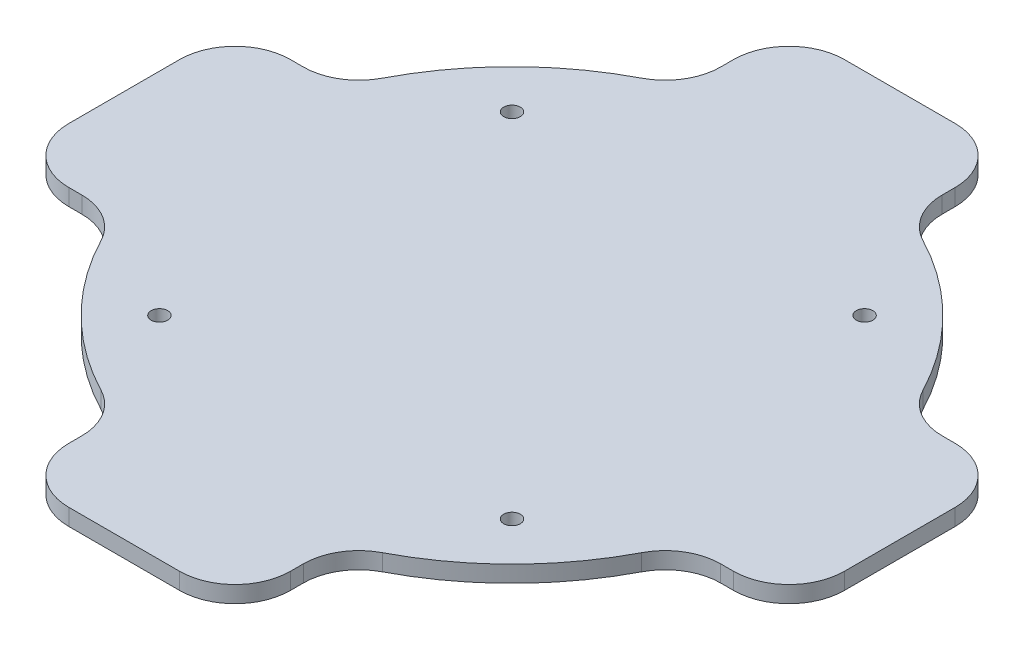
from build123d import *

# Parameters (mm, degrees)
SKETCH_1_R      = 0.75
EXTRUDE_2_DEPTH = 1.5


with BuildPart() as part:
    # 草图1 → 凸台-拉伸2 (new body)
    with BuildSketch(Plane(origin=(0, 0, 0), x_dir=(1, 0, 0), z_dir=(0, 1, 0))):
        with BuildLine():
            Line((28.831406487, -10), (30, -10))
            ThreePointArc((30, -10), (33.535533906, -8.535533906), (35, -5))
            Line((35, -5), (35, 0))
            Line((35, 0), (35, 5))
            ThreePointArc((35, 5), (33.535533906, 8.535533906), (30, 10))
            Line((30, 10), (28.831406487, 10))
            ThreePointArc((28.831406487, 10), (26.237033878, 10.725747929), (24.395805489, 12.692307692))
            ThreePointArc((24.395805489, 12.692307692), (19.445436483, 19.445436483), (12.692307692, 24.395805489))
            ThreePointArc((12.692307692, 24.395805489), (10.725747929, 26.237033878), (10, 28.831406487))
            Line((10, 28.831406487), (10, 30))
            ThreePointArc((10, 30), (8.535533906, 33.535533906), (5, 35))
            Line((5, 35), (0, 35))
            Line((0, 35), (-5, 35))
            ThreePointArc((-5, 35), (-8.535533906, 33.535533906), (-10, 30))
            Line((-10, 30), (-10, 28.831406487))
            ThreePointArc((-10, 28.831406487), (-10.725747929, 26.237033878), (-12.692307692, 24.395805489))
            ThreePointArc((-12.692307692, 24.395805489), (-19.445436483, 19.445436483), (-24.395805489, 12.692307692))
            ThreePointArc((-24.395805489, 12.692307692), (-26.237033878, 10.725747929), (-28.831406487, 10))
            Line((-28.831406487, 10), (-30, 10))
            ThreePointArc((-30, 10), (-33.535533906, 8.535533906), (-35, 5))
            Line((-35, 5), (-35, 0))
            Line((-35, 0), (-35, -5))
            ThreePointArc((-35, -5), (-33.535533906, -8.535533906), (-30, -10))
            Line((-30, -10), (-28.831406487, -10))
            ThreePointArc((-28.831406487, -10), (-26.237033878, -10.725747929), (-24.395805489, -12.692307692))
            ThreePointArc((-24.395805489, -12.692307692), (-19.445436483, -19.445436483), (-12.692307692, -24.395805489))
            ThreePointArc((-12.692307692, -24.395805489), (-10.725747929, -26.237033878), (-10, -28.831406487))
            Line((-10, -28.831406487), (-10, -30))
            ThreePointArc((-10, -30), (-8.535533906, -33.535533906), (-5, -35))
            Line((-5, -35), (0, -35))
            Line((0, -35), (5, -35))
            ThreePointArc((5, -35), (8.535533906, -33.535533906), (10, -30))
            Line((10, -30), (10, -28.831406487))
            ThreePointArc((10, -28.831406487), (10.725747929, -26.237033878), (12.692307692, -24.395805489))
            ThreePointArc((12.692307692, -24.395805489), (19.445436483, -19.445436483), (24.395805489, -12.692307692))
            ThreePointArc((24.395805489, -12.692307692), (26.237033878, -10.725747929), (28.831406487, -10))
        make_face()
        with Locations(Location((15.909902577, -15.909902577, 0), (0, 0, 270))):
            Circle(SKETCH_1_R, mode=Mode.SUBTRACT)
        with Locations(Location((-15.909902577, -15.909902577, 0), (0, 0, 270))):
            Circle(SKETCH_1_R, mode=Mode.SUBTRACT)
        with Locations(Location((-15.909902577, 15.909902577, 0), (0, 0, 270))):
            Circle(SKETCH_1_R, mode=Mode.SUBTRACT)
        with Locations(Location((15.909902577, 15.909902577, 0), (0, 0, 270))):
            Circle(SKETCH_1_R, mode=Mode.SUBTRACT)
    extrude(amount=EXTRUDE_2_DEPTH)


solid = part.part
